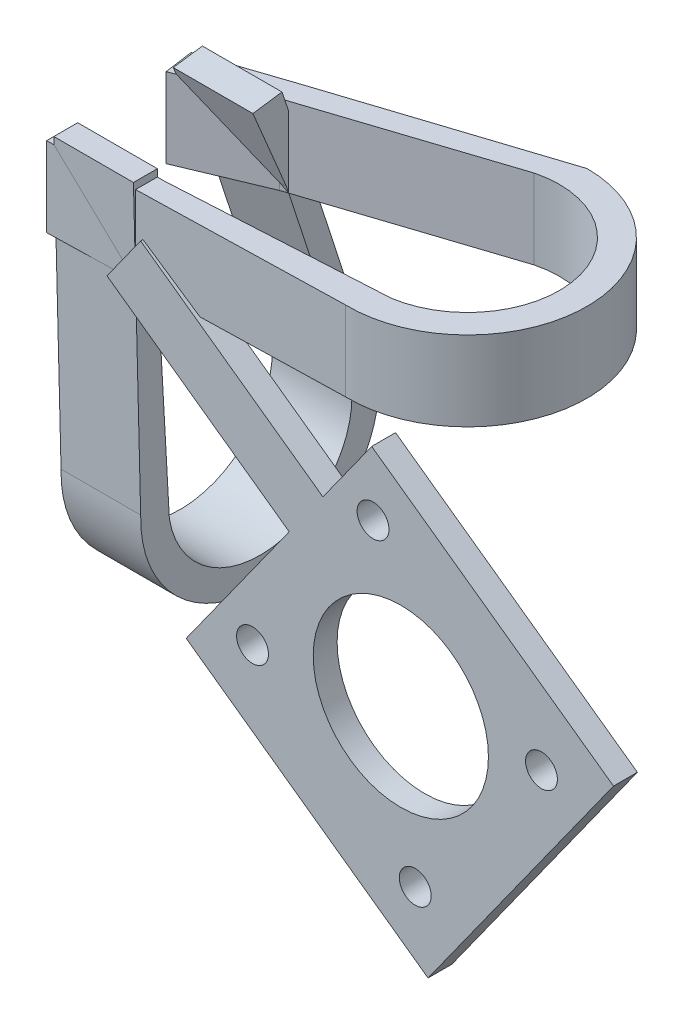
from build123d import *

# Parameters (mm, degrees)
BOSS_EXTRUDE1_DEPTH = 10
CIRPATTERN1_COUNT   = 2
CIRPATTERN1_ANGLE   = 90
SKETCH4_R           = 2
SKETCH4_R_2         = 11
BOSS_EXTRUDE2_DEPTH = 3


with BuildPart() as part:
    # Sketch1 → Boss-Extrude1 (new body)
    with BuildSketch(Plane(origin=(0, 0, 0), x_dir=(1, 0, 0), z_dir=(0, 1, 0))):
        with BuildLine():
            Line((0, 15), (-26.900155428, 6.278700475))
            Line((-26.900155428, 6.278700475), (-37.47437809, 2.750369919))
            Line((-37.47437809, 2.750369919), (-36.958650594, -0.903972442))
            Line((-36.958650594, -0.903972442), (-26.900155428, 3.317423045))
            Line((-26.900155428, 3.317423045), (-2.821131559, 11.193160892))
            ThreePointArc((-2.821131559, 11.193160892), (11.303828334, 2.338610491), (1.8517881, -11.393705054))
            Line((1.8517881, -11.393705054), (-25.145499842, -12.903972442))
            Line((-25.145499842, -12.903972442), (-32.586903668, -12.903972442))
            Line((-32.586903668, -12.903972442), (-36.958650594, -12.903972442))
            Line((-36.958650594, -12.903972442), (-36.958650594, -15.903972442))
            Line((-36.958650594, -15.903972442), (-0.325723138, -14.996463064))
            ThreePointArc((-0.325723138, -14.996463064), (14.99911574, -0.16287117), (0, 15))
        make_face()
    boss_extrude1 = extrude(amount=BOSS_EXTRUDE1_DEPTH)

    # CirPattern1: Boss-Extrude1 ×2 about axis
    cirpattern1_axis = Axis((-31.052075218, 5, 0), (0, 0, -1))
    for i in range(1, CIRPATTERN1_COUNT):
        add(boss_extrude1.rotate(cirpattern1_axis, i * CIRPATTERN1_ANGLE / (CIRPATTERN1_COUNT - 1)))

    # Sketch4 → Boss-Extrude2 (add)
    with BuildSketch(Plane(origin=(0, 0, 12.903972442), x_dir=(-1, 0, 0), z_dir=(0, 0, -1))):
        Polygon((25.145499842, 5), (29.375972464, -0.906575376), (6.490188193, -17.298084434), (19.427171172, -35.360667965), (-10.945093119, -57.114226389), (-34.236490518, -24.59483514), (-3.864226227, -2.841276715), (2.259715572, -11.391509058), align=None)
        with Locations((-4.040125025, -10.790378208)):
            Circle(SKETCH4_R, mode=Mode.SUBTRACT)
        with Locations((11.099283284, -31.92798252)):
            Circle(SKETCH4_R, mode=Mode.SUBTRACT)
        with Locations((-25.189607513, -27.394689404)):
            Circle(SKETCH4_R, mode=Mode.SUBTRACT)
        with Locations((-9.336361168, -48.002323435)):
            Circle(SKETCH4_R, mode=Mode.SUBTRACT)
        with Locations((-7.525518654, -29.277184542)):
            Circle(SKETCH4_R_2, mode=Mode.SUBTRACT)
    extrude(amount=-BOSS_EXTRUDE2_DEPTH)


solid = part.part
